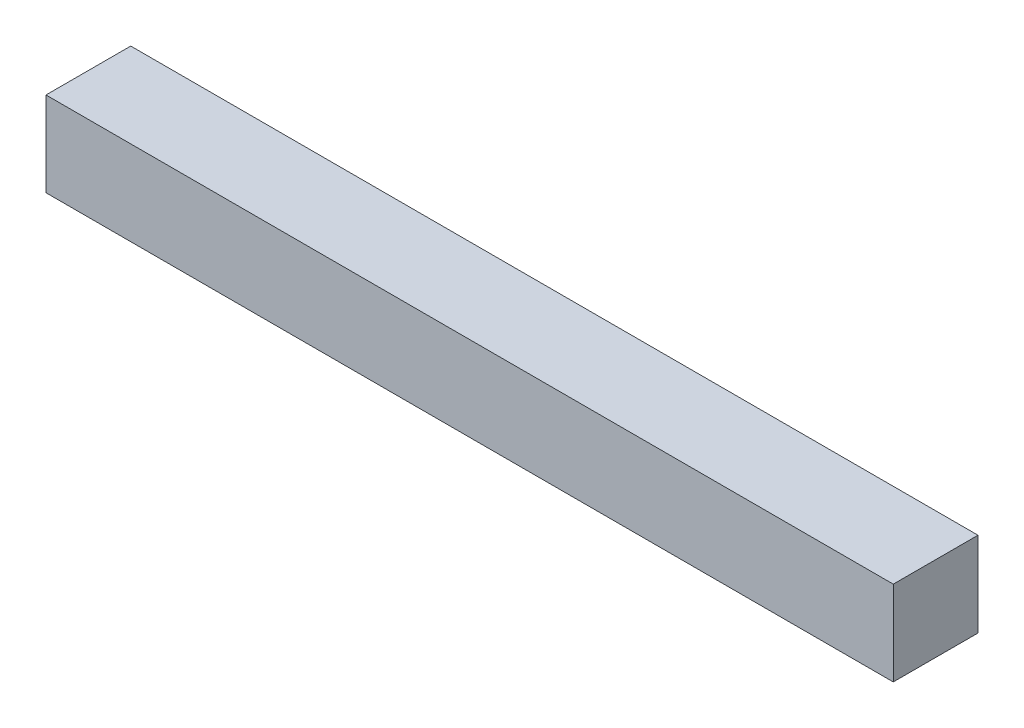
from build123d import *

# Parameters (mm, degrees)
STORE_EVAPORATOR_1_1_START = -650
SKETCH1_W                  = 1000
SKETCH1_H                  = 100
STORE_EVAPORATOR_1_1_DEPTH = 100


with BuildPart() as part:
    # Sketch1 → STORE_evaporator_1_1 (new body)
    with BuildSketch(Plane.XY.offset(STORE_EVAPORATOR_1_1_START)):
        with Locations((700, 1450)):
            Rectangle(SKETCH1_W, SKETCH1_H)
    extrude(amount=-STORE_EVAPORATOR_1_1_DEPTH)


solid = part.part
